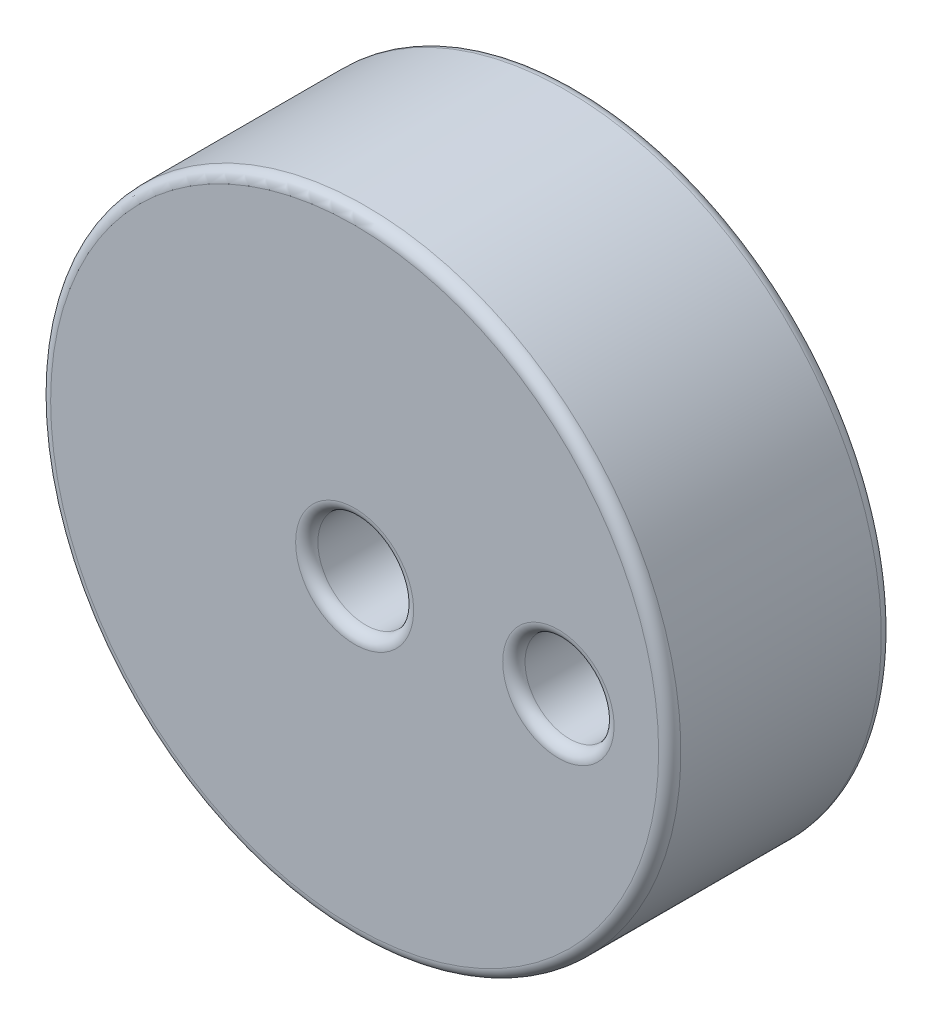
from build123d import *

# Parameters (mm, degrees)
SKETCH1_W          = 12
SKETCH1_H          = 6
SKETCH1_W_2        = 10.55
SKETCH1_H_2        = 4
SKETCH2_R          = 2
CUT_EXTRUDE1_DEPTH = 10
FILLET2_R          = 0.5


with BuildPart() as part:
    # Sketch1 → Revolve1 (revolve)
    with BuildSketch(Plane(origin=(0, 0, 0), x_dir=(1, 0, 0), z_dir=(0, 1, 0))):
        with Locations((8.15, -1.5)):
            Rectangle(SKETCH1_W, SKETCH1_H)
        with Locations((8.875, 3.5)):
            Rectangle(SKETCH1_W_2, SKETCH1_H_2)
    revolve(axis=Axis((0, 0, 0), (0, 0, -1)))

    # Sketch2 → Cut-Extrude1 (cut)
    with BuildSketch(Plane(origin=(0, 0, -5.5), x_dir=(-1, 0, 0), z_dir=(0, 0, -1))):
        with Locations((-9.15, 0)):
            Circle(SKETCH2_R)
    extrude(amount=-CUT_EXTRUDE1_DEPTH, mode=Mode.SUBTRACT)

    # Fillet2
    fillet2_edges = [part.edges().sort_by_distance(p)[0] for p in [
        (11.15, 0, 4.5),
        (11.15, 0, -5.5),
        (-2.15, 0, -1.5),
        (-3.6, 0, -5.5),
        (-14.15, 0, -5.5),
        (-14.15, 0, 4.5),
        (-2.15, 0, 4.5),
    ]]
    fillet(fillet2_edges, radius=FILLET2_R)


solid = part.part
